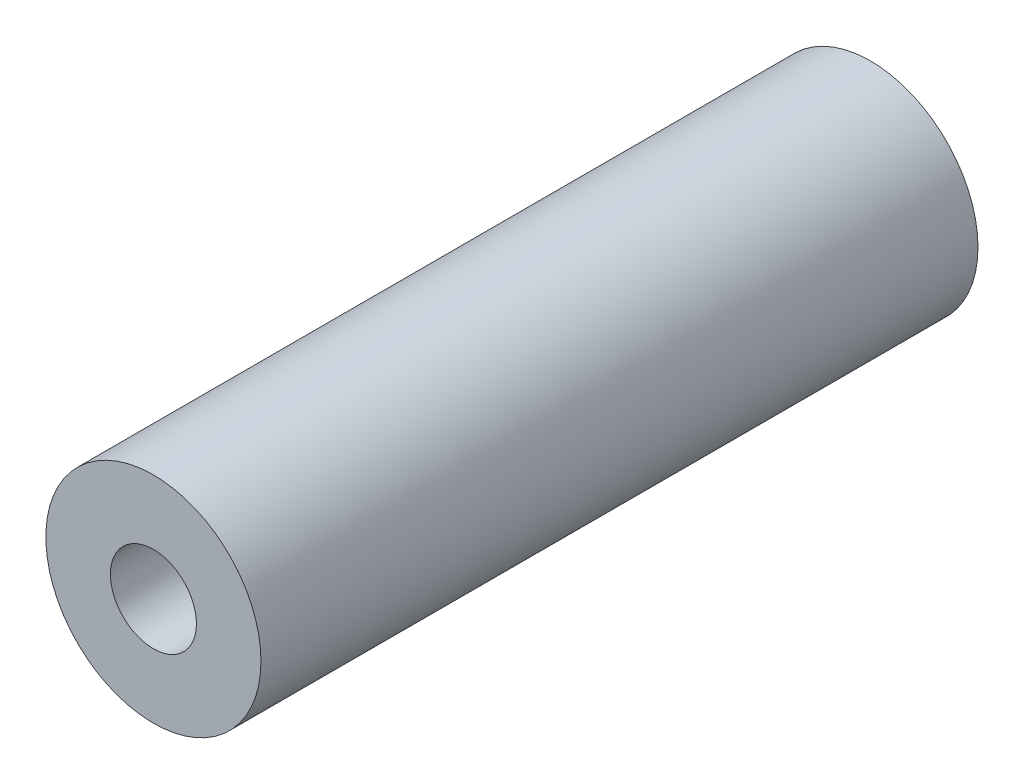
from build123d import *

# Parameters (mm, degrees)
CROQUIS1_R              = 2.25
CROQUIS1_R_2            = 0.99
SALIENTE_EXTRUIR1_DEPTH = 15
CROQUIS2_R              = 1.367663893
CROQUIS2_R_2            = 0.9
SALIENTE_EXTRUIR2_DEPTH = 5


with BuildPart() as part:
    # Croquis1 → Saliente-Extruir1 (new body)
    with BuildSketch(Plane.XY):
        Circle(CROQUIS1_R)
        Circle(CROQUIS1_R_2, mode=Mode.SUBTRACT)
    extrude(amount=SALIENTE_EXTRUIR1_DEPTH)

    # Croquis2 → Saliente-Extruir2 (add)
    with BuildSketch(Plane.XY.offset(15)):
        Circle(CROQUIS2_R)
        Circle(CROQUIS2_R_2, mode=Mode.SUBTRACT)
    extrude(amount=-SALIENTE_EXTRUIR2_DEPTH)


solid = part.part
